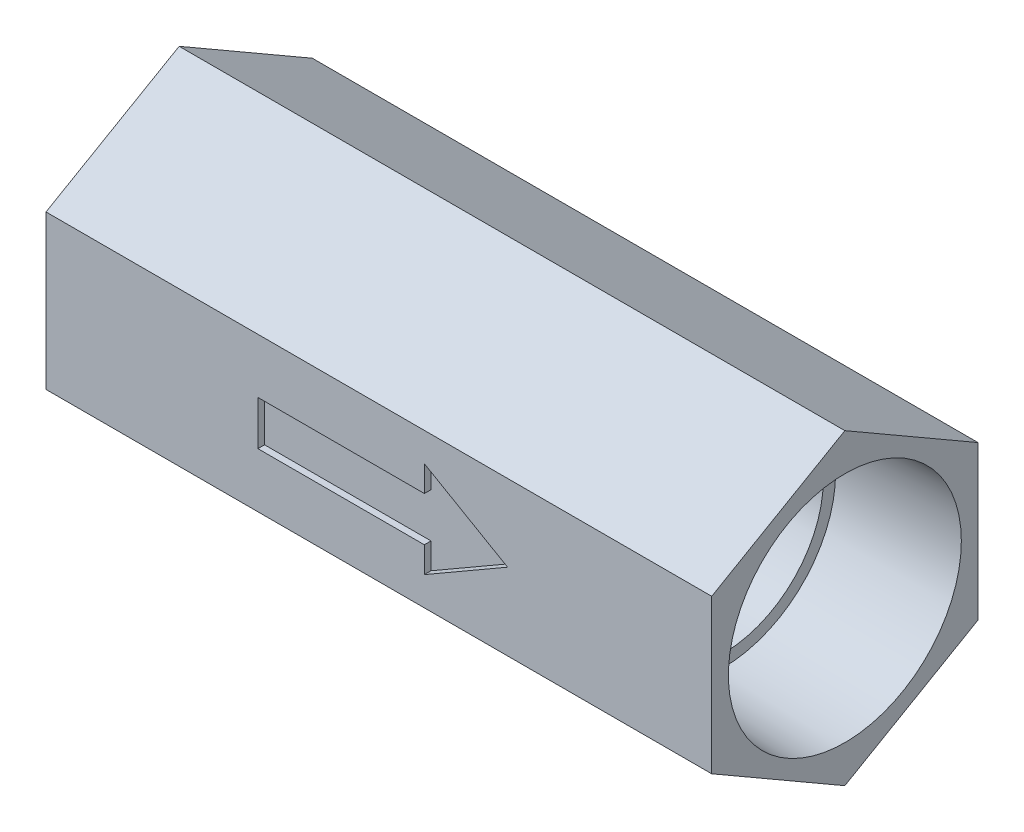
from build123d import *

# Parameters (mm, degrees)
BOSS_EXTRUDE1_DEPTH      = 38.1
BOSS_EXTRUDE1_DEPTH_BACK = 38.1
CUT_EXTRUDE1_DEPTH       = 0.762
SKETCH11_W               = 1.221153846
SKETCH11_H               = 0.325641026
CUT_EXTRUDE2_DEPTH       = 0.762


with BuildPart() as part:
    # Sketch1 → Boss-Extrude1 (new, two sides: drawn at the far end of the back side and taken through both)
    with BuildSketch(Plane(origin=(0, 0, 0), x_dir=(0, 0, -1), z_dir=(1, 0, 0)).offset(-BOSS_EXTRUDE1_DEPTH_BACK)):
        Polygon((0, 17.597636205), (-15.24, 8.798818102), (-15.24, -8.798818102), (0, -17.597636205), (15.24, -8.798818102), (15.24, 8.798818102), align=None)
    extrude(amount=BOSS_EXTRUDE1_DEPTH + BOSS_EXTRUDE1_DEPTH_BACK)

    # Sketch4 → 3/4 NPT Tapped Hole1 (revolve, cut)
    with BuildSketch(Plane(origin=(38.1, 0, 0), x_dir=(0, 0, -1), z_dir=(0, 1, 0))):
        Polygon((0, 0), (0, 24.693622455), (11.5062, 17.78), (11.5062, 13.97), (12.914204892, 13.97), (13.3324854, 0), align=None)
    revolve(axis=Axis((44.45, 0, 0), (-1, 0, 0)), mode=Mode.SUBTRACT)

    # Sketch9 → 3/4 NPT Tapped Hole2 (revolve, cut)
    with BuildSketch(Plane(origin=(-38.1, 0, 0), x_dir=(0, 0, 1), z_dir=(0, 1, 0))):
        Polygon((0, 0), (0, 24.693622455), (11.5062, 17.78), (11.5062, 13.97), (12.914204892, 13.97), (13.3324854, 0), align=None)
    revolve(axis=Axis((-44.45, 0, 0), (1, 0, 0)), mode=Mode.SUBTRACT)

    # Sketch10 → Cut-Extrude1 (cut)
    with BuildSketch(Plane.XY.offset(15.24)):
        Polygon((-13.843, 2.54), (-13.843, -2.54), (5.207, -2.54), (5.207, -5.499261314), (14.732, 0), (5.207, 5.499261314), (5.207, 2.54), align=None)
    extrude(amount=-CUT_EXTRUDE1_DEPTH, mode=Mode.SUBTRACT)

    # Sketch11 → Cut-Extrude2 (cut)
    # profile 1 of 9: a face of its own
    with BuildSketch(Plane(origin=(0, 0, -15.24), x_dir=(-1, 0, 0), z_dir=(0, 0, -1))):
        with BuildLine():
            Line((-8.092179487, 1.322407853), (-8.341498397, 1.131602564))
            add(Edge.make_bspline(
                [(-8.341498397, 1.131602564), (-8.359283739, 1.152798837), (-8.394614637, 1.19490561), (-8.451455485, 1.254032768), (-8.510693404, 1.309427684), (-8.57230575, 1.361354246), (-8.637401522, 1.407996598), (-8.704403818, 1.451785384), (-8.774433474, 1.491035404), (-8.871272547, 1.538626827), (-8.997953095, 1.58828941), (-9.157424128, 1.629930199), (-9.32389491, 1.65643798), (-9.437467018, 1.659308943), (-9.495234375, 1.660769231)],
                knots=[0, 0, 0, 0, 0.757959112, 1.505699292, 2.245454638, 2.979532153, 3.711538275, 4.438200793, 5.171680507, 5.909471876, 7.393775596, 8.890124382, 10.418191784, 12, 12, 12, 12], degree=3))
            add(Edge.make_bspline(
                [(-9.495234375, 1.660769231), (-9.527059939, 1.660402779), (-9.590415697, 1.659673277), (-9.684439669, 1.650049285), (-9.776707937, 1.636522687), (-9.867160482, 1.616451858), (-9.955682165, 1.591076696), (-10.042851701, 1.560755071), (-10.127407031, 1.523240323), (-10.210517862, 1.481776402), (-10.290146146, 1.434942934), (-10.365488939, 1.383858679), (-10.436271453, 1.329095284), (-10.50254968, 1.270447495), (-10.564391376, 1.208179431), (-10.621348436, 1.141627492), (-10.673223773, 1.071004449), (-10.721045645, 0.997241573), (-10.763874339, 0.920553719), (-10.799733587, 0.840657048), (-10.831488234, 0.758919754), (-10.856615404, 0.674418344), (-10.876504073, 0.587747406), (-10.890227024, 0.498674334), (-10.899741566, 0.407385211), (-10.900467441, 0.34550962), (-10.900833333, 0.314319912)],
                knots=[0, 0, 0, 0, 1.054917814, 2.100044995, 3.131103042, 4.146048494, 5.169673617, 6.183595914, 7.203665975, 8.234915748, 9.262203917, 10.264457458, 11.251630812, 12.227803204, 13.197192746, 14.159520551, 15.12972552, 16.100847026, 17.073214652, 18.039054194, 19.002613845, 19.979014051, 20.95965708, 21.949030935, 22.966165397, 24, 24, 24, 24], degree=3))
            add(Edge.make_bspline(
                [(-10.900833333, 0.314319912), (-10.899688683, 0.267392215), (-10.897441315, 0.175255905), (-10.877440326, 0.040299709), (-10.847046422, -0.088986903), (-10.80149372, -0.211795759), (-10.745324295, -0.329641199), (-10.674348883, -0.440529301), (-10.592146739, -0.546135756), (-10.497554944, -0.643964716), (-10.393772525, -0.733330738), (-10.282422634, -0.812025909), (-10.163782601, -0.877625838), (-10.039162373, -0.932214018), (-9.907602969, -0.974175478), (-9.76934097, -1.00371579), (-9.624677088, -1.022985482), (-9.525826276, -1.024830328), (-9.475517829, -1.025769231)],
                knots=[0, 0, 0, 0, 1.029171465, 2.020641659, 2.987623507, 3.938342917, 4.889210282, 5.84687017, 6.821220943, 7.821438502, 8.827599549, 9.822697543, 10.807740252, 11.797342354, 12.80366471, 13.83203677, 14.896651826, 16, 16, 16, 16], degree=3))
            add(Edge.make_bspline(
                [(-9.475517829, -1.025769231), (-9.420088961, -1.024237266), (-9.310991689, -1.021221994), (-9.151000694, -0.995677532), (-8.997842535, -0.954259278), (-8.851508974, -0.896294734), (-8.712412545, -0.820942652), (-8.580335575, -0.729595291), (-8.455166579, -0.621383732), (-8.379899773, -0.538758323), (-8.341498397, -0.496602564)],
                knots=[0, 0, 0, 0, 1.028121516, 2.023589091, 2.998037872, 3.967518031, 4.937445131, 5.927275754, 6.942489185, 8, 8, 8, 8], degree=3))
            Line((-8.341498397, -0.496602564), (-8.092179487, -0.6854998))
            add(Edge.make_bspline(
                [(-8.092179487, -0.6854998), (-8.112243773, -0.711388252), (-8.152276237, -0.763041154), (-8.217098866, -0.835859062), (-8.285386129, -0.904352008), (-8.357645237, -0.967967779), (-8.433044948, -1.02797933), (-8.512939117, -1.082681706), (-8.596277454, -1.132838436), (-8.682777588, -1.178764289), (-8.772347616, -1.219510649), (-8.86488021, -1.25439371), (-8.959976518, -1.284442717), (-9.057640886, -1.309164117), (-9.158075894, -1.328460028), (-9.26091911, -1.341359305), (-9.366392497, -1.350196613), (-9.437550072, -1.351002079), (-9.473609776, -1.351410256)],
                knots=[0, 0, 0, 0, 0.986787822, 1.968848986, 2.935600012, 3.899624008, 4.868462664, 5.837806735, 6.815139263, 7.798259679, 8.787526145, 9.778297419, 10.776456485, 11.791383307, 12.812564526, 13.85620153, 14.913611965, 16, 16, 16, 16], degree=3))
            add(Edge.make_bspline(
                [(-9.473609776, -1.351410256), (-9.507757959, -1.351172592), (-9.575281764, -1.350702639), (-9.674975631, -1.343089745), (-9.772030465, -1.332703197), (-9.866168876, -1.317063936), (-9.957904582, -1.298608713), (-10.046405969, -1.273869787), (-10.13254391, -1.246157329), (-10.215972334, -1.213586377), (-10.296762204, -1.176832411), (-10.374652947, -1.135292926), (-10.449608739, -1.089317234), (-10.522366514, -1.03991876), (-10.591851465, -0.985510779), (-10.658665734, -0.926848904), (-10.723183981, -0.864130851), (-10.763100702, -0.818905377), (-10.783170072, -0.796166867)],
                knots=[0, 0, 0, 0, 1.114604814, 2.203992996, 3.262667896, 4.300477797, 5.318619304, 6.316056647, 7.298880507, 8.271930387, 9.238335007, 10.195173496, 11.151986948, 12.108099108, 13.064862484, 14.031167946, 15.010108607, 16, 16, 16, 16], degree=3))
            add(Edge.make_bspline(
                [(-10.783170072, -0.796166867), (-10.815315263, -0.756668788), (-10.87921756, -0.678149487), (-10.96097443, -0.550890061), (-11.030958284, -0.418022472), (-11.087542155, -0.278848679), (-11.13177692, -0.133680978), (-11.162421289, 0.01755381), (-11.182334531, 0.174714444), (-11.184611721, 0.281609245), (-11.185769231, 0.335944511)],
                knots=[0, 0, 0, 0, 0.994628077, 1.977248131, 2.950237994, 3.925870899, 4.908910175, 5.911660606, 6.938484602, 8, 8, 8, 8], degree=3))
            add(Edge.make_bspline(
                [(-11.185769231, 0.335944511), (-11.184358448, 0.393054101), (-11.181582821, 0.505413654), (-11.158000921, 0.670308598), (-11.120065299, 0.828288795), (-11.066183835, 0.979059335), (-10.997871124, 1.123413232), (-10.913482696, 1.260247753), (-10.813998931, 1.390437993), (-10.700200066, 1.512008518), (-10.57540684, 1.623169216), (-10.441767631, 1.720964844), (-10.299544007, 1.802351447), (-10.150302813, 1.87038368), (-9.992926516, 1.922675443), (-9.827750889, 1.959281549), (-9.655086302, 1.982066361), (-9.53728253, 1.984946728), (-9.477425881, 1.986410256)],
                knots=[0, 0, 0, 0, 1.032925535, 2.032216505, 3.007276963, 3.968222605, 4.92396291, 5.891752235, 6.871517503, 7.883894988, 8.900124299, 9.891468569, 10.874487609, 11.85992873, 12.854644235, 13.869047385, 14.917252991, 16, 16, 16, 16], degree=3))
            add(Edge.make_bspline(
                [(-9.477425881, 1.986410256), (-9.44094561, 1.985972888), (-9.368736588, 1.985107162), (-9.26191811, 1.976665162), (-9.157921142, 1.962592104), (-9.056674037, 1.943436813), (-8.957684235, 1.919663028), (-8.861708303, 1.8886929), (-8.768183065, 1.85328119), (-8.67769837, 1.812497439), (-8.590688357, 1.766716895), (-8.507180125, 1.716447007), (-8.427837003, 1.661750098), (-8.35210069, 1.60309136), (-8.281238128, 1.53922981), (-8.213237358, 1.471921991), (-8.150407665, 1.399229165), (-8.11162441, 1.348061832), (-8.092179487, 1.322407853)],
                knots=[0, 0, 0, 0, 1.096760587, 2.17092713, 3.219439832, 4.250915756, 5.268269357, 6.278326846, 7.281116186, 8.274029601, 9.260640565, 10.235837813, 11.203064059, 12.156899882, 13.114053108, 14.069676657, 15.032185724, 16, 16, 16, 16], degree=3))
        make_face()
    # profile 2 of 9: a face of its own
    with BuildSketch(Plane(origin=(0, 0, -15.24), x_dir=(-1, 0, 0), z_dir=(0, 0, -1))):
        with BuildLine():
            Line((-7.522307692, 1.986410256), (-7.237371795, 1.986410256))
            Line((-7.237371795, 1.986410256), (-7.237371795, 0.611976162))
            add(Edge.make_bspline(
                [(-7.237371795, 0.611976162), (-7.206785386, 0.650206774), (-7.147232079, 0.724643735), (-7.046996316, 0.82176353), (-6.944062025, 0.905945136), (-6.834873948, 0.972956194), (-6.721435261, 1.025893915), (-6.603267527, 1.063438423), (-6.480348789, 1.086526204), (-6.396868831, 1.089427626), (-6.354579327, 1.090897436)],
                knots=[0, 0, 0, 0, 1.125788106, 2.19196713, 3.20547328, 4.180437432, 5.132270164, 6.079753143, 7.027236121, 8, 8, 8, 8], degree=3))
            add(Edge.make_bspline(
                [(-6.354579327, 1.090897436), (-6.311643899, 1.089314081), (-6.22760891, 1.086215074), (-6.105252155, 1.061710079), (-5.990987647, 1.019838689), (-5.885155061, 0.962537173), (-5.790064086, 0.89116968), (-5.705836085, 0.808772513), (-5.637037646, 0.71327403), (-5.590229876, 0.625048714), (-5.559773999, 0.546545701), (-5.540495556, 0.479202579), (-5.524149569, 0.404161987), (-5.509907666, 0.321462551), (-5.500415703, 0.230707288), (-5.492791514, 0.132305643), (-5.487370016, 0.026263257), (-5.487159918, -0.047142969), (-5.487051282, -0.085099159)],
                knots=[0, 0, 0, 0, 1.235656852, 2.418478516, 3.575258207, 4.727955599, 5.870717718, 6.98870536, 8.107142894, 9.245821548, 9.854588956, 10.528768408, 11.260415777, 12.065282286, 12.943670737, 13.886611085, 14.907229059, 16, 16, 16, 16], degree=3))
            Line((-5.487051282, -0.085099159), (-5.487051282, -1.27))
            Line((-5.487051282, -1.27), (-5.771987179, -1.27))
            Line((-5.771987179, -1.27), (-5.771987179, -0.17859375))
            add(Edge.make_bspline(
                [(-5.771987179, -0.17859375), (-5.772159812, -0.147004614), (-5.772490028, -0.086579973), (-5.773581633, -6.9289e-05), (-5.776018414, 0.078395062), (-5.779956163, 0.148561611), (-5.784097549, 0.210528179), (-5.789797415, 0.264204779), (-5.796428842, 0.309665132), (-5.802387665, 0.337028759), (-5.805060096, 0.349300881)],
                knots=[0, 0, 0, 0, 1.430932559, 2.737130458, 3.918967929, 4.986496826, 5.920444988, 6.731744033, 7.431208747, 8, 8, 8, 8], degree=3))
            add(Edge.make_bspline(
                [(-5.805060096, 0.349300881), (-5.815423518, 0.385309249), (-5.835347138, 0.454535126), (-5.881654945, 0.548571741), (-5.939493477, 0.628749328), (-6.010112064, 0.69398586), (-6.092261437, 0.745159185), (-6.186477262, 0.780599245), (-6.29187281, 0.802595393), (-6.366123788, 0.804808189), (-6.40482472, 0.805961538)],
                knots=[0, 0, 0, 0, 1.090059168, 2.095632401, 3.037101401, 3.955032261, 4.878929692, 5.839099886, 6.873700383, 8, 8, 8, 8], degree=3))
            add(Edge.make_bspline(
                [(-6.40482472, 0.805961538), (-6.4277462, 0.805529896), (-6.473107216, 0.804675687), (-6.540370649, 0.79609965), (-6.605620585, 0.782085456), (-6.669485418, 0.763122053), (-6.730611604, 0.737317887), (-6.79078087, 0.707445501), (-6.848288474, 0.670880156), (-6.904155608, 0.629853924), (-6.956150799, 0.584433499), (-7.004526111, 0.536493761), (-7.047650177, 0.485444329), (-7.086719541, 0.432104224), (-7.120445558, 0.375741811), (-7.149885139, 0.316900608), (-7.174863949, 0.255503233), (-7.187276106, 0.212890142), (-7.193486579, 0.19156851)],
                knots=[0, 0, 0, 0, 1.024319606, 2.027102035, 3.025350316, 4.005802111, 5.00026367, 5.987881639, 7.005602596, 8.042517216, 9.083927026, 10.089214625, 11.084353441, 12.06828073, 13.041928858, 14.016821737, 15.00770877, 16, 16, 16, 16], degree=3))
            add(Edge.make_bspline(
                [(-7.193486579, 0.19156851), (-7.197060202, 0.176128076), (-7.204847567, 0.142481469), (-7.213297451, 0.086987618), (-7.220861024, 0.022502124), (-7.227255065, -0.050877207), (-7.231176722, -0.133419262), (-7.235402412, -0.224560775), (-7.236975411, -0.324872651), (-7.237235718, -0.394627861), (-7.237371795, -0.431092748)],
                knots=[0, 0, 0, 0, 0.607992626, 1.324890765, 2.152360218, 3.099583803, 4.150613268, 5.323148443, 6.60066238, 8, 8, 8, 8], degree=3))
            Line((-7.237371795, -0.431092748), (-7.237371795, -1.27))
            Line((-7.237371795, -1.27), (-7.522307692, -1.27))
            Line((-7.522307692, -1.27), (-7.522307692, 1.986410256))
        make_face()
    # profile 3 of 9: a face of its own
    with BuildSketch(Plane(origin=(0, 0, -15.24), x_dir=(-1, 0, 0), z_dir=(0, 0, -1))):
        with BuildLine():
            Line((-2.931532452, -0.537307692), (-2.678397436, -0.670235377))
            add(Edge.make_bspline(
                [(-2.678397436, -0.670235377), (-2.698569204, -0.706016113), (-2.737815478, -0.775631256), (-2.805307585, -0.871273015), (-2.876057536, -0.957313443), (-2.953258993, -1.031453915), (-3.034602202, -1.0960891), (-3.120538253, -1.152638413), (-3.211514538, -1.200824499), (-3.307535359, -1.241421435), (-3.409407095, -1.272635762), (-3.517376614, -1.294683162), (-3.631650756, -1.308311413), (-3.709979076, -1.309894505), (-3.750087139, -1.310705128)],
                knots=[0, 0, 0, 0, 1.120438281, 2.179929193, 3.190490725, 4.156257408, 5.095198341, 6.022838206, 6.959905092, 7.901321166, 8.864066838, 9.862729781, 10.905609505, 12, 12, 12, 12], degree=3))
            add(Edge.make_bspline(
                [(-3.750087139, -1.310705128), (-3.794665933, -1.309664476), (-3.881626246, -1.307634466), (-4.008208731, -1.290133445), (-4.127388632, -1.261583519), (-4.239159248, -1.221700492), (-4.343246863, -1.169605705), (-4.439858353, -1.106142461), (-4.52950178, -1.031636773), (-4.609352312, -0.945443285), (-4.681237835, -0.853203224), (-4.744670543, -0.7570861), (-4.797699784, -0.657333746), (-4.840836794, -0.5545812), (-4.875675493, -0.449476096), (-4.899956717, -0.341062122), (-4.913953703, -0.229632699), (-4.916098593, -0.154251545), (-4.917179487, -0.116264022)],
                knots=[0, 0, 0, 0, 1.145258523, 2.234067595, 3.276747158, 4.290159414, 5.277019952, 6.260822364, 7.254936242, 8.264827045, 9.274100331, 10.257902744, 11.220704747, 12.172965371, 13.118907548, 14.062713208, 15.023725156, 16, 16, 16, 16], degree=3))
            add(Edge.make_bspline(
                [(-4.917179487, -0.116264022), (-4.916218695, -0.080617998), (-4.914314531, -0.009972284), (-4.902312317, 0.094590031), (-4.881041365, 0.196215842), (-4.851852843, 0.294989591), (-4.814159926, 0.390745898), (-4.768047842, 0.483543042), (-4.713444756, 0.573282276), (-4.671287402, 0.629890833), (-4.650052083, 0.658405449)],
                knots=[0, 0, 0, 0, 1.024358464, 2.0301432, 3.019427413, 4.004406732, 4.986367066, 5.972626655, 6.978780325, 8, 8, 8, 8], degree=3))
            add(Edge.make_bspline(
                [(-4.650052083, 0.658405449), (-4.621288685, 0.692757924), (-4.564673041, 0.760374674), (-4.468918347, 0.849218727), (-4.36523174, 0.923644152), (-4.254912623, 0.98533634), (-4.136678821, 1.032211719), (-4.012119678, 1.067143598), (-3.879816897, 1.086717936), (-3.789370018, 1.089482757), (-3.743090946, 1.090897436)],
                knots=[0, 0, 0, 0, 1.030682036, 2.02871468, 2.997146059, 3.962720338, 4.930598197, 5.918074684, 6.934738563, 8, 8, 8, 8], degree=3))
            add(Edge.make_bspline(
                [(-3.743090946, 1.090897436), (-3.695513475, 1.08966912), (-3.602177323, 1.087259445), (-3.466076756, 1.064919842), (-3.337298106, 1.029493596), (-3.215892906, 0.979461229), (-3.101848847, 0.91490935), (-2.995907216, 0.834952108), (-2.896256201, 0.742044272), (-2.83828199, 0.670594789), (-2.80878105, 0.634236779)],
                knots=[0, 0, 0, 0, 1.056321875, 2.072262726, 3.055038591, 4.01806755, 4.982017516, 5.957941055, 6.960871419, 8, 8, 8, 8], degree=3))
            add(Edge.make_bspline(
                [(-2.80878105, 0.634236779), (-2.788708756, 0.606837816), (-2.748697775, 0.552222265), (-2.698580763, 0.463167001), (-2.655076554, 0.369993819), (-2.620303082, 0.271196621), (-2.592145821, 0.167946002), (-2.571774278, 0.059503836), (-2.559827553, -0.054097583), (-2.557479234, -0.131500958), (-2.556282051, -0.170961538)],
                knots=[0, 0, 0, 0, 0.94817472, 1.890038105, 2.849395472, 3.817997239, 4.812318967, 5.836947057, 6.897266129, 8, 8, 8, 8], degree=3))
            Line((-2.556282051, -0.170961538), (-4.63224359, -0.170961538))
            add(Edge.make_bspline(
                [(-4.63224359, -0.170961538), (-4.630846947, -0.201532674), (-4.628100505, -0.261649579), (-4.615296053, -0.349615932), (-4.595113237, -0.433411749), (-4.56674773, -0.512408509), (-4.532397092, -0.587637982), (-4.490318621, -0.658542115), (-4.440117739, -0.724797952), (-4.384123712, -0.786998141), (-4.321796561, -0.842388974), (-4.256225784, -0.891965943), (-4.186472335, -0.933518163), (-4.113086217, -0.967245634), (-4.036186097, -0.993649221), (-3.955747749, -1.011672172), (-3.871929458, -1.023743619), (-3.814792399, -1.025085887), (-3.785704127, -1.025769231)],
                knots=[0, 0, 0, 0, 1.094153842, 2.151609401, 3.174256925, 4.172055639, 5.149267565, 6.128595816, 7.11444997, 8.118368179, 9.117203808, 10.09244225, 11.054858984, 12.015122123, 12.976791628, 13.957293641, 14.960065497, 16, 16, 16, 16], degree=3))
            add(Edge.make_bspline(
                [(-3.785704127, -1.025769231), (-3.757264157, -1.025217637), (-3.700833802, -1.024123168), (-3.61679531, -1.013480649), (-3.534118738, -0.996271898), (-3.453146275, -0.972785979), (-3.375521293, -0.944141263), (-3.303634259, -0.909576528), (-3.237521492, -0.871340686), (-3.175729672, -0.827607624), (-3.115793842, -0.774078769), (-3.056337444, -0.70728065), (-2.99258648, -0.628279821), (-2.952681635, -0.568820539), (-2.931532452, -0.537307692)],
                knots=[0, 0, 0, 0, 0.99110716, 1.966546729, 2.947904876, 3.932708344, 4.903319531, 5.828989031, 6.710028674, 7.56322171, 8.463672341, 9.504779593, 10.677557249, 12, 12, 12, 12], degree=3))
        make_face()
        with BuildLine():
            add(Edge.make_bspline(
                [(-2.841217949, 0.113974359), (-2.85164703, 0.151768537), (-2.871719653, 0.224510165), (-2.913662641, 0.325240115), (-2.960898967, 0.41476414), (-3.01679868, 0.492397092), (-3.080134239, 0.561343136), (-3.15329094, 0.621594282), (-3.235329215, 0.675494398), (-3.325825007, 0.720989879), (-3.421657198, 0.75971568), (-3.521992815, 0.785682749), (-3.624370951, 0.803471405), (-3.693617053, 0.805127947), (-3.72846254, 0.805961538)],
                knots=[0, 0, 0, 0, 1.154881502, 2.222775134, 3.210006277, 4.132804581, 5.035138423, 5.962687519, 6.919655026, 7.923214229, 8.944639381, 9.960483929, 10.97369054, 12, 12, 12, 12], degree=3))
            add(Edge.make_bspline(
                [(-3.72846254, 0.805961538), (-3.756900959, 0.805406665), (-3.813117735, 0.804309797), (-3.895940847, 0.793904751), (-3.97547886, 0.776705463), (-4.052318656, 0.753151538), (-4.125453301, 0.721756592), (-4.196387127, 0.684941807), (-4.263316486, 0.640000514), (-4.305173233, 0.605747838), (-4.326319111, 0.58844351)],
                knots=[0, 0, 0, 0, 1.04873581, 2.073130211, 3.073294108, 4.04793562, 5.032784715, 6.005352987, 6.992311501, 8, 8, 8, 8], degree=3))
            add(Edge.make_bspline(
                [(-4.326319111, 0.58844351), (-4.341462302, 0.574750809), (-4.372108431, 0.54704012), (-4.413057333, 0.499297911), (-4.452264476, 0.447816137), (-4.487945718, 0.390625203), (-4.520673243, 0.328376353), (-4.551298365, 0.261594641), (-4.578863182, 0.189773302), (-4.594371796, 0.139724017), (-4.602350761, 0.113974359)],
                knots=[0, 0, 0, 0, 0.879870761, 1.780643979, 2.707998968, 3.669668524, 4.684282772, 5.740141944, 6.837334558, 8, 8, 8, 8], degree=3))
            Line((-4.602350761, 0.113974359), (-2.841217949, 0.113974359))
        make_face(mode=Mode.SUBTRACT)
    # profile 4 of 9: a face of its own
    with BuildSketch(Plane(origin=(0, 0, -15.24), x_dir=(-1, 0, 0), z_dir=(0, 0, -1))):
        with BuildLine():
            Line((0.293076923, 0.547102364), (0.054570313, 0.398910256))
            add(Edge.make_bspline(
                [(0.054570313, 0.398910256), (0.028417506, 0.431411728), (-0.023059853, 0.495385357), (-0.112449018, 0.577944367), (-0.207709372, 0.648853041), (-0.310468744, 0.706641444), (-0.420583005, 0.751292331), (-0.537617906, 0.782888303), (-0.661556757, 0.802577152), (-0.746524473, 0.804814925), (-0.790061098, 0.805961538)],
                knots=[0, 0, 0, 0, 1.026593902, 2.0206758, 2.988051866, 3.946915611, 4.916868779, 5.907761954, 6.927957743, 8, 8, 8, 8], degree=3))
            add(Edge.make_bspline(
                [(-0.790061098, 0.805961538), (-0.824858152, 0.805002832), (-0.893390003, 0.803114685), (-0.993997728, 0.791312308), (-1.089830434, 0.769865629), (-1.181488791, 0.741607262), (-1.268320885, 0.703733784), (-1.350554218, 0.657642077), (-1.428918198, 0.604075255), (-1.501141957, 0.542017117), (-1.56720827, 0.474526897), (-1.624447999, 0.402178902), (-1.674283646, 0.327140144), (-1.713386906, 0.247536777), (-1.745386525, 0.165189929), (-1.766438336, 0.078545217), (-1.780467024, -0.011287333), (-1.782072058, -0.072536112), (-1.782884615, -0.10354367)],
                knots=[0, 0, 0, 0, 1.112346261, 2.190735716, 3.231507886, 4.247384806, 5.251966152, 6.253067467, 7.256802811, 8.280671706, 9.291813951, 10.270744147, 11.225547591, 12.165006084, 13.100104208, 14.043489273, 15.009504848, 16, 16, 16, 16], degree=3))
            add(Edge.make_bspline(
                [(-1.782884615, -0.10354367), (-1.781270579, -0.14415574), (-1.778064255, -0.224832667), (-1.752935074, -0.34392066), (-1.711801219, -0.459058579), (-1.655505883, -0.56942896), (-1.584315911, -0.671567944), (-1.500702228, -0.763174364), (-1.404618489, -0.842473189), (-1.296911303, -0.908216123), (-1.180109636, -0.961067506), (-1.055477183, -0.998720587), (-0.924032383, -1.021446667), (-0.834037691, -1.024309559), (-0.788153045, -1.025769231)],
                knots=[0, 0, 0, 0, 0.966302908, 1.919585723, 2.883856336, 3.870342332, 4.860282998, 5.839159637, 6.814385684, 7.815993281, 8.834850808, 9.858348828, 10.908058873, 12, 12, 12, 12], degree=3))
            add(Edge.make_bspline(
                [(-0.788153045, -1.025769231), (-0.74610227, -1.024590401), (-0.66346134, -1.022273688), (-0.542659588, -1.002743843), (-0.427652098, -0.970772832), (-0.318442956, -0.926188893), (-0.21523172, -0.86856036), (-0.118685254, -0.797477398), (-0.026882453, -0.714984911), (0.027089805, -0.651196466), (0.054570313, -0.618717949)],
                knots=[0, 0, 0, 0, 1.039848629, 2.043578496, 3.018386758, 3.987534228, 4.954977003, 5.934852016, 6.948509513, 8, 8, 8, 8], degree=3))
            Line((0.054570313, -0.618717949), (0.293076923, -0.775178285))
            add(Edge.make_bspline(
                [(0.293076923, -0.775178285), (0.27893665, -0.795943445), (0.250703038, -0.837404841), (0.203506549, -0.895864861), (0.152597845, -0.950585245), (0.098175536, -1.001492641), (0.040950234, -1.049805273), (-0.021032941, -1.093213487), (-0.085775375, -1.134157219), (-0.15403711, -1.170998896), (-0.225112387, -1.204115345), (-0.298901191, -1.232591621), (-0.375082879, -1.25705736), (-0.45374702, -1.276504096), (-0.535048699, -1.292026071), (-0.618777653, -1.3023255), (-0.704905045, -1.310013791), (-0.763118354, -1.310472685), (-0.792605168, -1.310705128)],
                knots=[0, 0, 0, 0, 0.954134338, 1.905101784, 2.851144739, 3.791306361, 4.734911809, 5.6936923, 6.663572882, 7.643865596, 8.638447847, 9.640600242, 10.646758161, 11.676244097, 12.717260333, 13.78922464, 14.880174919, 16, 16, 16, 16], degree=3))
            add(Edge.make_bspline(
                [(-0.792605168, -1.310705128), (-0.837609327, -1.30989661), (-0.925817805, -1.308311909), (-1.054924651, -1.290887077), (-1.178308478, -1.264618383), (-1.295927131, -1.226914138), (-1.407798922, -1.178377664), (-1.513819537, -1.119089605), (-1.613637924, -1.048557625), (-1.706266992, -0.968037112), (-1.791340161, -0.880733102), (-1.864388919, -0.786526391), (-1.927748557, -0.688880583), (-1.978627971, -0.585639085), (-2.019129112, -0.478174068), (-2.046801353, -0.365624636), (-2.064699044, -0.248918663), (-2.066770395, -0.169332406), (-2.067820513, -0.128984375)],
                knots=[0, 0, 0, 0, 1.1129367, 2.181364009, 3.217532258, 4.231199276, 5.232079859, 6.230262199, 7.231623845, 8.250719726, 9.263571943, 10.242672461, 11.195837495, 12.138959767, 13.085126421, 14.0317438, 15.002148558, 16, 16, 16, 16], degree=3))
            add(Edge.make_bspline(
                [(-2.067820513, -0.128984375), (-2.067420448, -0.101608224), (-2.066624654, -0.04715254), (-2.057497048, 0.033669413), (-2.045705576, 0.113415022), (-2.025725086, 0.191073453), (-2.002646798, 0.267822538), (-1.973186852, 0.342737208), (-1.938628886, 0.41616559), (-1.899393191, 0.487918531), (-1.855225544, 0.556815613), (-1.806347568, 0.621906437), (-1.754600206, 0.683972939), (-1.69756259, 0.74087235), (-1.63765519, 0.794880181), (-1.573183118, 0.844553622), (-1.504516166, 0.890038664), (-1.432685581, 0.932176371), (-1.357733164, 0.969695287), (-1.28011197, 1.002019724), (-1.200289722, 1.029644561), (-1.118138734, 1.051514795), (-1.034204277, 1.069854886), (-0.947824921, 1.081391789), (-0.859331119, 1.089543623), (-0.79940887, 1.090442413), (-0.769072516, 1.090897436)],
                knots=[0, 0, 0, 0, 0.990994727, 1.971252077, 2.943264845, 3.907940874, 4.872158414, 5.844625996, 6.82015047, 7.809835459, 8.804511986, 9.781214284, 10.756496977, 11.728388426, 12.696359165, 13.676225489, 14.672885716, 15.677705647, 16.690706858, 17.706033469, 18.721040654, 19.747369689, 20.783475414, 21.830280724, 22.901553713, 24, 24, 24, 24], degree=3))
            add(Edge.make_bspline(
                [(-0.769072516, 1.090897436), (-0.731081275, 1.090061149), (-0.655288691, 1.088392755), (-0.542856765, 1.074351407), (-0.432080839, 1.053181943), (-0.324904538, 1.021819448), (-0.222627343, 0.983843131), (-0.126891613, 0.941195883), (-0.039950947, 0.891670779), (0.039811937, 0.837496103), (0.112546214, 0.776390139), (0.178998503, 0.707622399), (0.2405315, 0.631550779), (0.275417231, 0.575484151), (0.293076923, 0.547102364)],
                knots=[0, 0, 0, 0, 1.095225653, 2.184976855, 3.262915854, 4.344593502, 5.400796181, 6.407717688, 7.363229445, 8.282371371, 9.184954523, 10.097238608, 11.036792983, 12, 12, 12, 12], degree=3))
        make_face()
    # profile 5 of 9: a face of its own
    with BuildSketch(Plane(origin=(0, 0, -15.24), x_dir=(-1, 0, 0), z_dir=(0, 0, -1))):
        Polygon((0.862948718, 1.986410256), (1.147884615, 1.986410256), (1.147884615, 0.103798077), (2.203673878, 1.050192308), (2.613269231, 1.050192308), (1.388299279, -0.048846154), (2.735384615, -1.27), (2.32642528, -1.27), (1.147884615, -0.200854367), (1.147884615, -1.27), (0.862948718, -1.27), align=None)
    # profile 6 of 9: a face of its own
    with BuildSketch(Plane(origin=(0, 0, -15.24), x_dir=(-1, 0, 0), z_dir=(0, 0, -1))):
        with Locations((3.468076923, -0.048846154)):
            Rectangle(SKETCH11_W, SKETCH11_H)
    # profile 7 of 9: a face of its own
    with BuildSketch(Plane(origin=(0, 0, -15.24), x_dir=(-1, 0, 0), z_dir=(0, 0, -1))):
        Polygon((5.910384615, 1.905), (7.375769231, -1.27), (7.066028646, -1.27), (6.596647636, -0.252371795), (5.157339744, -0.252371795), (4.674602364, -1.27), (4.363589744, -1.27), (5.869679487, 1.905), align=None)
        Polygon((5.886851963, 1.286154848), (5.311892027, 0.073269231), (6.446547476, 0.073269231), align=None, mode=Mode.SUBTRACT)
    # profile 8 of 9: a face of its own
    with BuildSketch(Plane(origin=(0, 0, -15.24), x_dir=(-1, 0, 0), z_dir=(0, 0, -1))):
        Polygon((7.945641026, 1.905), (8.230576923, 1.905), (8.230576923, -0.944358974), (9.451730769, -0.944358974), (9.451730769, -1.27), (7.945641026, -1.27), align=None)
    # profile 9 of 9: a face of its own
    with BuildSketch(Plane(origin=(0, 0, -15.24), x_dir=(-1, 0, 0), z_dir=(0, 0, -1))):
        Polygon((9.980897436, 1.905), (10.265833333, 1.905), (10.265833333, -0.944358974), (11.486987179, -0.944358974), (11.486987179, -1.27), (9.980897436, -1.27), align=None)
    extrude(amount=-CUT_EXTRUDE2_DEPTH, mode=Mode.SUBTRACT)


solid = part.part
